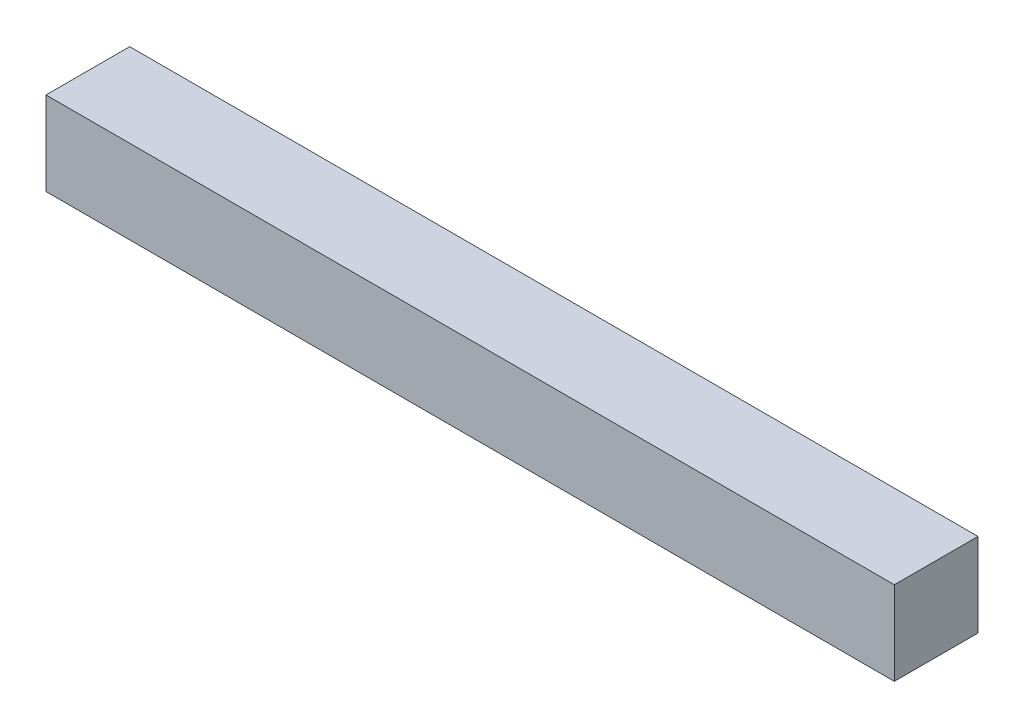
from build123d import *

# Parameters (mm, degrees)
SKETCH2_W           = 50.7
SKETCH2_H           = 5
BOSS_EXTRUDE1_DEPTH = 5


with BuildPart() as part:
    # Sketch2 → Boss-Extrude1 (new body)
    with BuildSketch(Plane.XY.offset(1)):
        with Locations((0, 11.5)):
            Rectangle(SKETCH2_W, SKETCH2_H)
    extrude(amount=BOSS_EXTRUDE1_DEPTH)


solid = part.part
